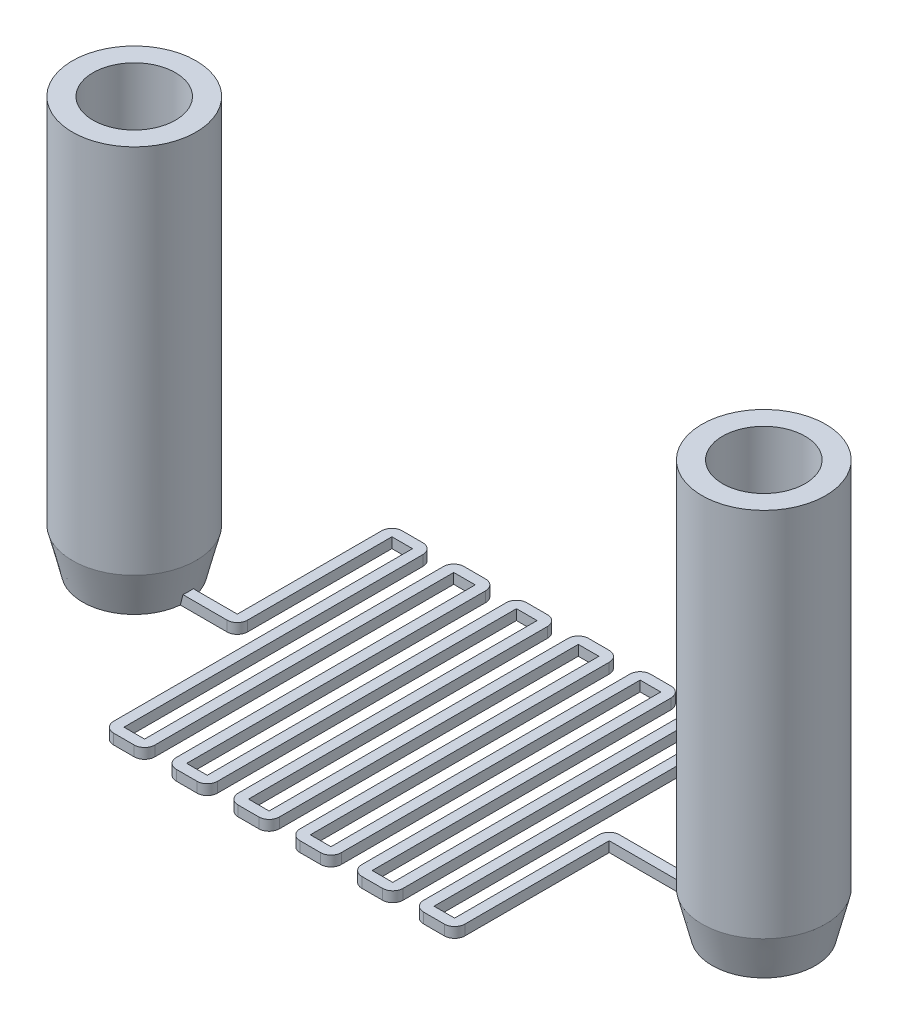
from build123d import *

# Parameters (mm, degrees)
BOSS_EXTRUDE1_DEPTH = 1
SKETCH5_R           = 4
CUT_EXTRUDE1_DEPTH  = 35


with BuildPart() as part:
    # Sketch2 → Boss-Extrude1 (new body)
    with BuildSketch(Plane(origin=(0, 0, 0), x_dir=(1, 0, 0), z_dir=(0, 1, 0))):
        with BuildLine():
            Line((-32.760220782, -0.5), (-23.260220782, -0.5))
            ThreePointArc((-23.260220782, -0.5), (-22.553114001, -0.207106781), (-22.260220782, 0.5))
            Line((-22.260220782, 0.5), (-22.260220782, 14.5))
            Line((-22.260220782, 14.5), (-20.260220782, 14.5))
            Line((-20.260220782, 14.5), (-20.260220782, 0))
            Line((-20.260220782, 0), (-20.260220782, -14.5))
            ThreePointArc((-20.260220782, -14.5), (-19.967327563, -15.207106781), (-19.260220782, -15.5))
            Line((-19.260220782, -15.5), (-17.260220782, -15.5))
            ThreePointArc((-17.260220782, -15.5), (-16.553114001, -15.207106781), (-16.260220782, -14.5))
            Line((-16.260220782, -14.5), (-16.260220782, 0))
            Line((-16.260220782, 0), (-16.260220782, 14.5))
            Line((-16.260220782, 14.5), (-14.174535805, 14.5))
            Line((-14.174535805, 14.5), (-14.174535805, -14.5))
            ThreePointArc((-14.174535805, -14.5), (-13.881642586, -15.207106781), (-13.174535805, -15.5))
            Line((-13.174535805, -15.5), (-11.174535805, -15.5))
            ThreePointArc((-11.174535805, -15.5), (-10.467429024, -15.207106781), (-10.174535805, -14.5))
            Line((-10.174535805, -14.5), (-10.174535805, 14.5))
            Line((-10.174535805, 14.5), (-8.174535805, 14.5))
            Line((-8.174535805, 14.5), (-8.174535805, -14.5))
            ThreePointArc((-8.174535805, -14.5), (-7.881642586, -15.207106781), (-7.174535805, -15.5))
            Line((-7.174535805, -15.5), (-5.174535805, -15.5))
            ThreePointArc((-5.174535805, -15.5), (-4.467429024, -15.207106781), (-4.174535805, -14.5))
            Line((-4.174535805, -14.5), (-4.174535805, 14.5))
            Line((-4.174535805, 14.5), (-2.174535805, 14.5))
            Line((-2.174535805, 14.5), (-2.174535805, -14.5))
            ThreePointArc((-2.174535805, -14.5), (-1.881642586, -15.207106781), (-1.174535805, -15.5))
            Line((-1.174535805, -15.5), (0.825464195, -15.5))
            ThreePointArc((0.825464195, -15.5), (1.532570976, -15.207106781), (1.825464195, -14.5))
            Line((1.825464195, -14.5), (1.825464195, 14.5))
            Line((1.825464195, 14.5), (3.825464195, 14.5))
            Line((3.825464195, 14.5), (3.825464195, -14.5))
            ThreePointArc((3.825464195, -14.5), (4.118357414, -15.207106781), (4.825464195, -15.5))
            Line((4.825464195, -15.5), (6.825464195, -15.5))
            ThreePointArc((6.825464195, -15.5), (7.532570976, -15.207106781), (7.825464195, -14.5))
            Line((7.825464195, -14.5), (7.825464195, 14.5))
            Line((7.825464195, 14.5), (9.825464195, 14.5))
            Line((9.825464195, 14.5), (9.825464195, -14.5))
            ThreePointArc((9.825464195, -14.5), (10.118357414, -15.207106781), (10.825464195, -15.5))
            Line((10.825464195, -15.5), (12.825464195, -15.5))
            ThreePointArc((12.825464195, -15.5), (13.532570976, -15.207106781), (13.825464195, -14.5))
            Line((13.825464195, -14.5), (13.825464195, -0.5))
            Line((13.825464195, -0.5), (28.325464195, -0.5))
            ThreePointArc((28.325464195, -0.5), (28.825464195, 0), (28.325464195, 0.5))
            Line((28.325464195, 0.5), (13.825464195, 0.5))
            ThreePointArc((13.825464195, 0.5), (13.118357414, 0.207106781), (12.825464195, -0.5))
            Line((12.825464195, -0.5), (12.825464195, -14.5))
            Line((12.825464195, -14.5), (10.825464195, -14.5))
            Line((10.825464195, -14.5), (10.825464195, 14.5))
            ThreePointArc((10.825464195, 14.5), (10.532570976, 15.207106781), (9.825464195, 15.5))
            Line((9.825464195, 15.5), (7.825464195, 15.5))
            ThreePointArc((7.825464195, 15.5), (7.118357414, 15.207106781), (6.825464195, 14.5))
            Line((6.825464195, 14.5), (6.825464195, -14.5))
            Line((6.825464195, -14.5), (4.825464195, -14.5))
            Line((4.825464195, -14.5), (4.825464195, 14.5))
            ThreePointArc((4.825464195, 14.5), (4.532570976, 15.207106781), (3.825464195, 15.5))
            Line((3.825464195, 15.5), (1.825464195, 15.5))
            ThreePointArc((1.825464195, 15.5), (1.118357414, 15.207106781), (0.825464195, 14.5))
            Line((0.825464195, 14.5), (0.825464195, -14.5))
            Line((0.825464195, -14.5), (-1.174535805, -14.5))
            Line((-1.174535805, -14.5), (-1.174535805, 14.5))
            ThreePointArc((-1.174535805, 14.5), (-1.467429024, 15.207106781), (-2.174535805, 15.5))
            Line((-2.174535805, 15.5), (-4.174535805, 15.5))
            ThreePointArc((-4.174535805, 15.5), (-4.881642586, 15.207106781), (-5.174535805, 14.5))
            Line((-5.174535805, 14.5), (-5.174535805, -14.5))
            Line((-5.174535805, -14.5), (-7.174535805, -14.5))
            Line((-7.174535805, -14.5), (-7.174535805, 14.5))
            ThreePointArc((-7.174535805, 14.5), (-7.467429024, 15.207106781), (-8.174535805, 15.5))
            Line((-8.174535805, 15.5), (-10.174535805, 15.5))
            ThreePointArc((-10.174535805, 15.5), (-10.881642586, 15.207106781), (-11.174535805, 14.5))
            Line((-11.174535805, 14.5), (-11.174535805, -14.5))
            Line((-11.174535805, -14.5), (-13.174535805, -14.5))
            Line((-13.174535805, -14.5), (-13.174535805, 14.5))
            ThreePointArc((-13.174535805, 14.5), (-13.467429024, 15.207106781), (-14.174535805, 15.5))
            Line((-14.174535805, 15.5), (-16.260220782, 15.5))
            ThreePointArc((-16.260220782, 15.5), (-16.967327563, 15.207106781), (-17.260220782, 14.5))
            Line((-17.260220782, 14.5), (-17.260220782, 0))
            Line((-17.260220782, 0), (-17.260220782, -14.5))
            Line((-17.260220782, -14.5), (-19.260220782, -14.5))
            Line((-19.260220782, -14.5), (-19.260220782, 0))
            Line((-19.260220782, 0), (-19.260220782, 14.5))
            ThreePointArc((-19.260220782, 14.5), (-19.553114001, 15.207106781), (-20.260220782, 15.5))
            Line((-20.260220782, 15.5), (-22.260220782, 15.5))
            ThreePointArc((-22.260220782, 15.5), (-22.967327563, 15.207106781), (-23.260220782, 14.5))
            Line((-23.260220782, 14.5), (-23.260220782, 0.5))
            Line((-23.260220782, 0.5), (-32.760220782, 0.5))
            ThreePointArc((-32.760220782, 0.5), (-33.260220782, 0), (-32.760220782, -0.5))
        make_face()
    extrude(amount=BOSS_EXTRUDE1_DEPTH)

    # Sketch3 → Revolve1 (revolve)
    with BuildSketch(Plane.XY, mode=Mode.PRIVATE) as revolve1_sk:
        Polygon((-32.760220782, 0), (-37.760220782, 0), (-38.760220782, 4), (-38.760220782, 40), (-32.760220782, 40), align=None)
    revolve(revolve1_sk.sketch.rotate(Axis((-32.760220782, 0, 0), (0, 1, 0)), 174.260829523), axis=Axis((-32.760220782, 0, 0), (0, 1, 0)))

    # Sketch4 → Revolve2 (revolve)
    with BuildSketch(Plane.XY, mode=Mode.PRIVATE) as revolve2_sk:
        Polygon((28.325464195, 0), (33.325464195, 0), (34.325464195, 4), (34.325464195, 40), (28.325464195, 40), align=None)
    revolve(revolve2_sk.sketch.rotate(Axis((28.325464195, 0, 0), (0, 1, 0)), 185.739170027), axis=Axis((28.325464195, 0, 0), (0, 1, 0)))

    # Sketch5 → Cut-Extrude1 (cut)
    with BuildSketch(Plane(origin=(0, 40, 0), x_dir=(1, 0, 0), z_dir=(0, 1, 0))):
        with Locations(Location((-32.760220782, 0, 0), (0, 0, 270))):
            Circle(SKETCH5_R)
        with Locations(Location((28.325464195, 0, 0), (0, 0, 270))):
            Circle(SKETCH5_R)
    extrude(amount=-CUT_EXTRUDE1_DEPTH, mode=Mode.SUBTRACT)


solid = part.part
